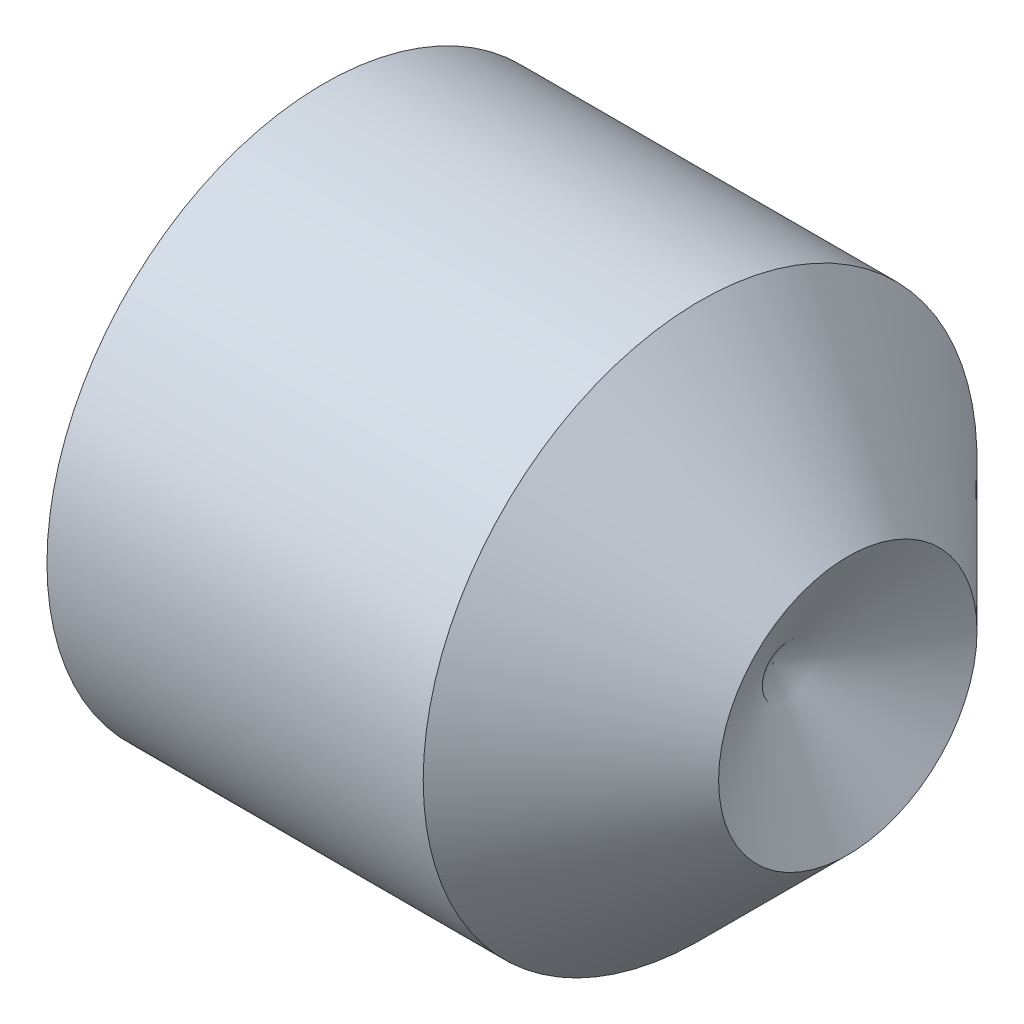
from build123d import *

# Parameters (mm, degrees)
HEX_2_DEPTH = 1.2


with BuildPart() as part:
    # BodySke → BaseBody (revolve)
    with BuildSketch(Plane.XY, mode=Mode.PRIVATE) as basebody_sk:
        Polygon((0, 0), (0, 1.2195), (0.161946751, 1.5), (2.2, 1.5), (3, 0.7), (2.595854812, 0), align=None)
    revolve(basebody_sk.sketch.rotate(Axis((-12.7, 0, 0), (1, 0, 0)), 90), axis=Axis((-12.7, 0, 0), (1, 0, 0)))

    # Sketch2 → Hex 2 (cut)
    with BuildSketch(Plane.ZY):
        Polygon((0.433012702, 0.75), (-0.433012702, 0.75), (-0.866025404, 0), (-0.433012702, -0.75), (0.433012702, -0.75), (0.866025404, 0), align=None)
    extrude(amount=-HEX_2_DEPTH, mode=Mode.SUBTRACT)


solid = part.part
